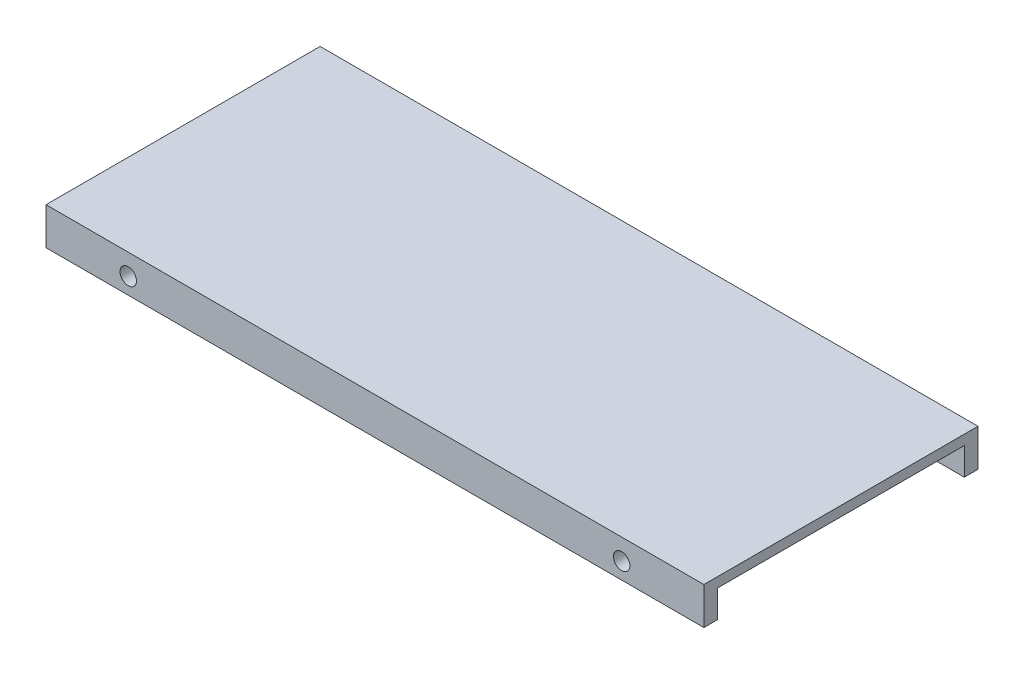
from build123d import *

# Parameters (mm, degrees)
SKETCH1_W           = 1200
SKETCH1_H           = 500
BOSS_EXTRUDE1_DEPTH = 68
SKETCH3_R           = 15
CUT_EXTRUDE2_DEPTH  = 1302.77724669
SKETCH4_R           = 15
CUT_EXTRUDE3_DEPTH  = 1302.77724669
SKETCH2_W           = 1200
SKETCH2_H           = 450
CUT_EXTRUDE1_DEPTH  = 50


with BuildPart() as part:
    # Sketch1 → Boss-Extrude1 (new body)
    with BuildSketch(Plane(origin=(0, 0, 0), x_dir=(1, 0, 0), z_dir=(0, 1, 0))):
        with Locations((600, 250)):
            Rectangle(SKETCH1_W, SKETCH1_H)
    extrude(amount=BOSS_EXTRUDE1_DEPTH)

    # Sketch3 → Cut-Extrude2 (cut, through all)
    with BuildSketch(Plane.XY):
        with Locations((150, 30)):
            Circle(SKETCH3_R)
    extrude(amount=-CUT_EXTRUDE2_DEPTH, mode=Mode.SUBTRACT)

    # Sketch4 → Cut-Extrude3 (cut, through all)
    with BuildSketch(Plane(origin=(0, 0, -500), x_dir=(-1, 0, 0), z_dir=(0, 0, -1))):
        with Locations((-1050, 30)):
            Circle(SKETCH4_R)
    extrude(amount=-CUT_EXTRUDE3_DEPTH, mode=Mode.SUBTRACT)

    # Sketch2 → Cut-Extrude1 (cut)
    with BuildSketch(Plane.XZ):
        with Locations((600, -250)):
            Rectangle(SKETCH2_W, SKETCH2_H)
    extrude(amount=-CUT_EXTRUDE1_DEPTH, mode=Mode.SUBTRACT)


solid = part.part
